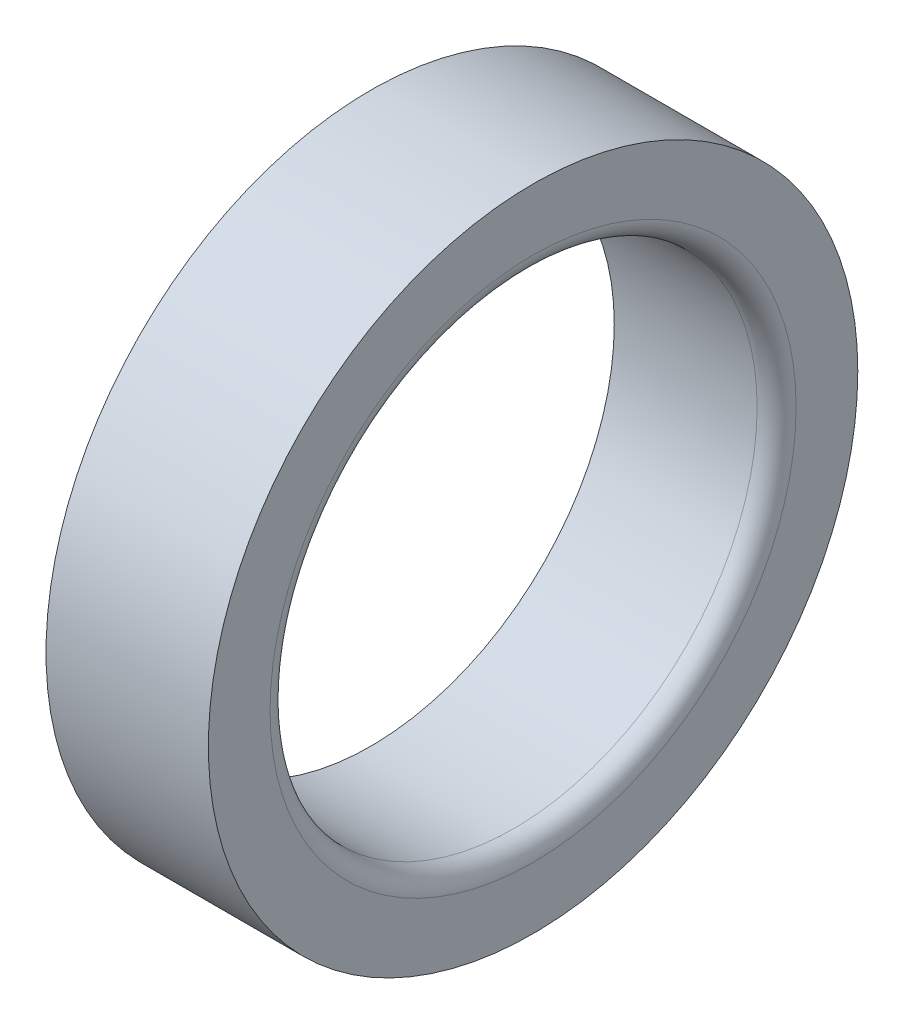
from build123d import *

# Parameters (mm, degrees)
SKETCH1_R           = 12.7
BOSS_EXTRUDE1_DEPTH = 6.35
CUT_EXTRUDE1_REACH  = 21.05
SKETCH2_R           = 9.525
FILLET1_R           = 0.762


with BuildPart() as part:
    # Sketch1 → Boss-Extrude1 (new body)
    with BuildSketch(Plane(origin=(0, 0, 0), x_dir=(0, 0, -1), z_dir=(1, 0, 0))):
        Circle(SKETCH1_R)
    extrude(amount=BOSS_EXTRUDE1_DEPTH)

    # Sketch2 → Cut-Extrude1 (cut, up to next)
    with BuildSketch(Plane(origin=(6.35, 0, 0), x_dir=(0, 0, -1), z_dir=(1, 0, 0)), mode=Mode.PRIVATE) as cut_extrude1_sk1:
        Circle(SKETCH2_R)
    cut_extrude1_tool1 = extrude(cut_extrude1_sk1.sketch, amount=-CUT_EXTRUDE1_REACH, mode=Mode.PRIVATE) & part.part
    add(cut_extrude1_tool1.solids().sort_by_distance((6.35, 0, 0))[0], mode=Mode.SUBTRACT)

    # Fillet1
    fillet1_edges = [part.edges().sort_by_distance(p)[0] for p in [
        (6.35, 0, 9.525),
    ]]
    fillet(fillet1_edges, radius=FILLET1_R)


solid = part.part
